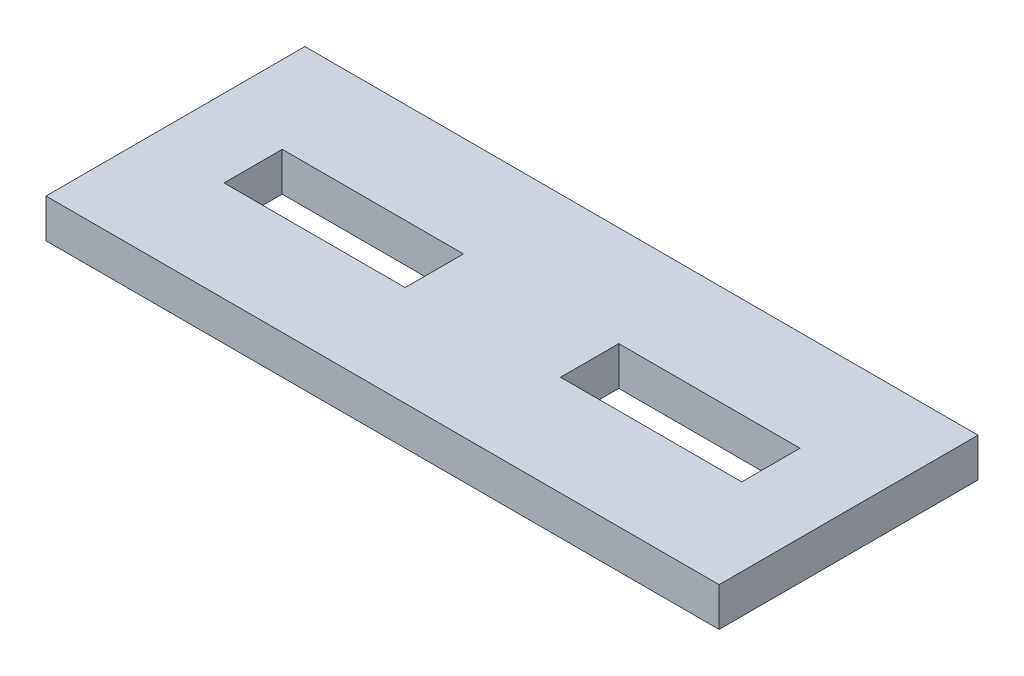
from build123d import *

# Parameters (mm, degrees)
SKETCH1_W                     = 52
SKETCH1_H                     = 20
SKETCH1_W_2                   = 14
SKETCH1_H_2                   = 4.5
SLOTTED_BRACKET_EXTRUDE_DEPTH = 3


with BuildPart() as part:
    # Sketch1 → Slotted_Bracket_Extrude (new body)
    with BuildSketch(Plane(origin=(0, 0, 0), x_dir=(1, 0, 0), z_dir=(0, 1, 0))):
        Rectangle(SKETCH1_W, SKETCH1_H)
        with Locations((-13, 0)):
            Rectangle(SKETCH1_W_2, SKETCH1_H_2, mode=Mode.SUBTRACT)
        with Locations((13, 0)):
            Rectangle(SKETCH1_W_2, SKETCH1_H_2, mode=Mode.SUBTRACT)
    extrude(amount=SLOTTED_BRACKET_EXTRUDE_DEPTH)


solid = part.part
